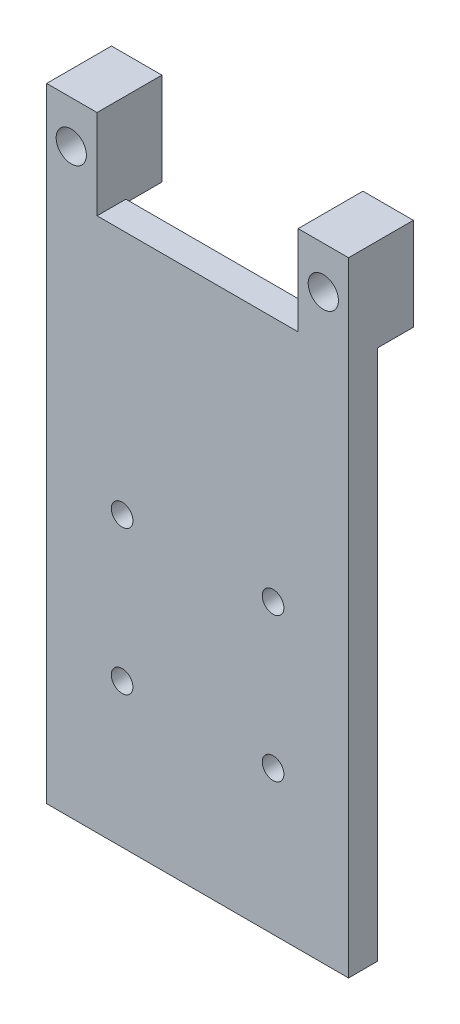
from build123d import *

# Parameters (mm, degrees)
SALIENTE_EXTRUIR1_DEPTH = 4
CROQUIS2_W              = 7
CROQUIS2_H              = 12.866645138
SALIENTE_EXTRUIR2_DEPTH = 5
CROQUIS3_R              = 2.1
CORTAR_EXTRUIR1_DEPTH   = 10
CROQUIS4_R              = 1.5
CORTAR_EXTRUIR2_DEPTH   = 10
CROQUIS5_R              = 1.5
CORTAR_EXTRUIR3_DEPTH   = 10


with BuildPart() as part:
    # Croquis1 → Saliente-Extruir1 (new body)
    with BuildSketch(Plane.XY):
        Polygon((31.808893405, -1059.380585752), (31.808893405, -1140.619885182), (-10.106831803, -1140.619885182), (-10.106831803, -1059.380585752), (-10.106831803, -1054.003240044), (-3.106831803, -1054.003240044), (-3.106831803, -1066.423001802), (24.808893405, -1066.423001802), (24.808893405, -1054.003240044), (31.808893405, -1054.003240044), align=None)
    extrude(amount=SALIENTE_EXTRUIR1_DEPTH)

    # Croquis2 → Saliente-Extruir2 (add)
    with BuildSketch(Plane(origin=(0, 0, 0), x_dir=(-1, 0, 0), z_dir=(0, 0, -1))):
        with Locations((6.606831803, -1060.436562613)):
            Rectangle(CROQUIS2_W, CROQUIS2_H)
        with Locations((-28.308893405, -1060.436562613)):
            Rectangle(CROQUIS2_W, CROQUIS2_H)
    extrude(amount=SALIENTE_EXTRUIR2_DEPTH)

    # Croquis3 → Cortar-Extruir1 (cut)
    with BuildSketch(Plane.XY.offset(4)):
        with Locations((-6.691106595, -1059.869885182)):
            Circle(CROQUIS3_R)
        with Locations((28.308893405, -1059.869885182)):
            Circle(CROQUIS3_R)
    extrude(amount=-CORTAR_EXTRUIR1_DEPTH, mode=Mode.SUBTRACT)

    # Croquis4 → Cortar-Extruir2 (cut)
    with BuildSketch(Plane.XY.offset(4)):
        with Locations((21.329962103, -1120.619885182)):
            Circle(CROQUIS4_R)
        with Locations((0.372099499, -1120.619885182)):
            Circle(CROQUIS4_R)
    extrude(amount=-CORTAR_EXTRUIR2_DEPTH, mode=Mode.SUBTRACT)

    # Croquis5 → Cortar-Extruir3 (cut)
    with BuildSketch(Plane.XY.offset(4)):
        with Locations((0.372099499, -1100.615007654)):
            Circle(CROQUIS5_R)
        with Locations((21.329962103, -1100.619885182)):
            Circle(CROQUIS5_R)
    extrude(amount=-CORTAR_EXTRUIR3_DEPTH, mode=Mode.SUBTRACT)


solid = part.part
